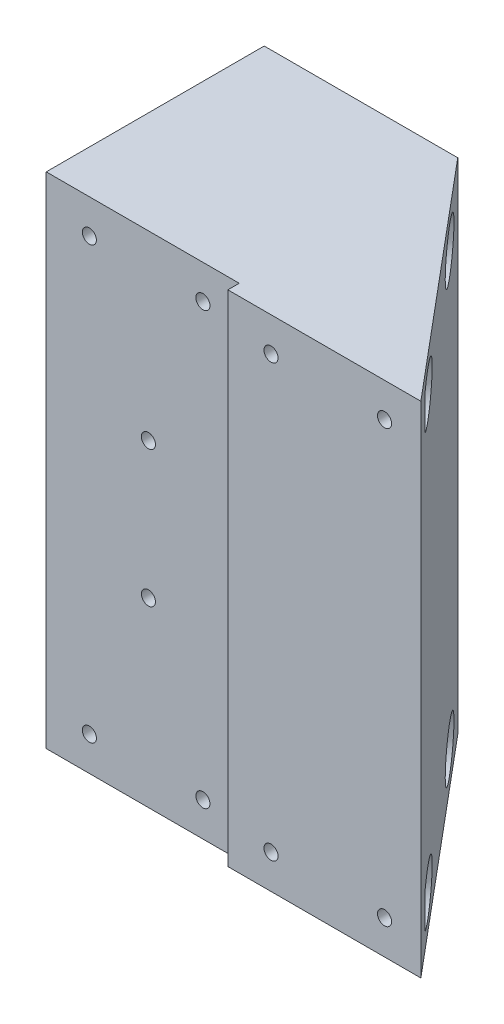
from build123d import *

# Parameters (mm, degrees)
SKETCH1_W           = 85
SKETCH1_H           = 110
BOSS_EXTRUDE1_DEPTH = 50.5
SKETCH2_W           = 42.5
SKETCH2_H           = 110
CUT_EXTRUDE1_DEPTH  = 2.5
CUT_EXTRUDE2_REACH  = 87.988
SKETCH3_W           = 130
SKETCH3_H           = 130
CUT_EXTRUDE3_REACH  = 86.47
SKETCH4_R           = 1.55
SKETCH5_R           = 1.55
CUT_EXTRUDE5_DEPTH  = 86.915656315
SKETCH9_R           = 5
CUT_EXTRUDE6_DEPTH  = 55
SKETCH10_R          = 5
CUT_EXTRUDE7_DEPTH  = 40


with BuildPart() as part:
    # Sketch1 → Boss-Extrude1 (new body)
    with BuildSketch(Plane.XY):
        Rectangle(SKETCH1_W, SKETCH1_H)
    extrude(amount=BOSS_EXTRUDE1_DEPTH)

    # Sketch2 → Cut-Extrude1 (cut)
    with BuildSketch(Plane.XY.offset(50.5)):
        with Locations((-21.25, 0)):
            Rectangle(SKETCH2_W, SKETCH2_H)
    extrude(amount=-CUT_EXTRUDE1_DEPTH, mode=Mode.SUBTRACT)

    # Sketch3 → Cut-Extrude2 (cut, up to next)
    with BuildSketch(Plane(origin=(0.073628012, 0, -0.061781238), x_dir=(0, 1, 0), z_dir=(-0.7660444431189792, 0, 0.6427876096865379)), mode=Mode.PRIVATE) as cut_extrude2_sk1:
        with Locations((-1.816321809, -4.4988995)):
            Rectangle(SKETCH3_W, SKETCH3_H)
    cut_extrude2_tool1 = extrude(cut_extrude2_sk1.sketch, amount=-CUT_EXTRUDE2_REACH, mode=Mode.PRIVATE) & part.part
    add(cut_extrude2_tool1.solids().sort_by_distance((2.965465, -1.816322, 3.384576))[0], mode=Mode.SUBTRACT)

    # Sketch4 → Cut-Extrude3 (cut, up to next)
    with BuildSketch(Plane.XY.offset(48), mode=Mode.PRIVATE) as cut_extrude3_sk1:
        with Locations((-8, 47.5)):
            Circle(SKETCH4_R)
    cut_extrude3_tool1 = extrude(cut_extrude3_sk1.sketch, amount=-CUT_EXTRUDE3_REACH, mode=Mode.PRIVATE) & part.part
    # Sketch4 → Cut-Extrude3 (cut, up to next)
    with BuildSketch(Plane.XY.offset(48), mode=Mode.PRIVATE) as cut_extrude3_sk2:
        with Locations((-33, 47.5)):
            Circle(SKETCH4_R)
    cut_extrude3_tool2 = extrude(cut_extrude3_sk2.sketch, amount=-CUT_EXTRUDE3_REACH, mode=Mode.PRIVATE) & part.part
    # Sketch4 → Cut-Extrude3 (cut, up to next)
    with BuildSketch(Plane.XY.offset(48), mode=Mode.PRIVATE) as cut_extrude3_sk3:
        with Locations((-20, 15)):
            Circle(SKETCH4_R)
    cut_extrude3_tool3 = extrude(cut_extrude3_sk3.sketch, amount=-CUT_EXTRUDE3_REACH, mode=Mode.PRIVATE) & part.part
    # Sketch4 → Cut-Extrude3 (cut, up to next)
    with BuildSketch(Plane.XY.offset(48), mode=Mode.PRIVATE) as cut_extrude3_sk4:
        with Locations((-20, -15)):
            Circle(SKETCH4_R)
    cut_extrude3_tool4 = extrude(cut_extrude3_sk4.sketch, amount=-CUT_EXTRUDE3_REACH, mode=Mode.PRIVATE) & part.part
    # Sketch4 → Cut-Extrude3 (cut, up to next)
    with BuildSketch(Plane.XY.offset(48), mode=Mode.PRIVATE) as cut_extrude3_sk5:
        with Locations((-8, -47.5)):
            Circle(SKETCH4_R)
    cut_extrude3_tool5 = extrude(cut_extrude3_sk5.sketch, amount=-CUT_EXTRUDE3_REACH, mode=Mode.PRIVATE) & part.part
    # Sketch4 → Cut-Extrude3 (cut, up to next)
    with BuildSketch(Plane.XY.offset(48), mode=Mode.PRIVATE) as cut_extrude3_sk6:
        with Locations((-33, -47.5)):
            Circle(SKETCH4_R)
    cut_extrude3_tool6 = extrude(cut_extrude3_sk6.sketch, amount=-CUT_EXTRUDE3_REACH, mode=Mode.PRIVATE) & part.part
    add(cut_extrude3_tool1.solids().sort_by_distance((-8, 47.5, 48))[0], mode=Mode.SUBTRACT)
    add(cut_extrude3_tool2.solids().sort_by_distance((-33, 47.5, 48))[0], mode=Mode.SUBTRACT)
    add(cut_extrude3_tool3.solids().sort_by_distance((-20, 15, 48))[0], mode=Mode.SUBTRACT)
    add(cut_extrude3_tool4.solids().sort_by_distance((-20, -15, 48))[0], mode=Mode.SUBTRACT)
    add(cut_extrude3_tool5.solids().sort_by_distance((-8, -47.5, 48))[0], mode=Mode.SUBTRACT)
    add(cut_extrude3_tool6.solids().sort_by_distance((-33, -47.5, 48))[0], mode=Mode.SUBTRACT)

    # Sketch5 → Cut-Extrude5 (cut, through all)
    with BuildSketch(Plane.XY.offset(50.5)):
        with Locations((9.5, 47.5)):
            Circle(SKETCH5_R)
        with Locations((34.5, 47.5)):
            Circle(SKETCH5_R)
        with Locations((34.5, -47.5)):
            Circle(SKETCH5_R)
        with Locations((9.5, -47.5)):
            Circle(SKETCH5_R)
    extrude(amount=-CUT_EXTRUDE5_DEPTH, mode=Mode.SUBTRACT)

    # Sketch9 → Cut-Extrude6 (cut)
    with BuildSketch(Plane(origin=(0, 0, -10), x_dir=(-1, 0, 0), z_dir=(0, 0, -1))):
        with Locations((-34.5, 47.5)):
            Circle(SKETCH9_R)
        with Locations((-9.5, 47.5)):
            Circle(SKETCH9_R)
        with Locations((-34.5, -47.5)):
            Circle(SKETCH9_R)
        with Locations((-9.5, -47.5)):
            Circle(SKETCH9_R)
    extrude(amount=-CUT_EXTRUDE6_DEPTH, mode=Mode.SUBTRACT)

    # Sketch10 → Cut-Extrude7 (cut)
    with BuildSketch(Plane(origin=(0, 0, 0), x_dir=(-1, 0, 0), z_dir=(0, 0, -1))):
        with Locations((8, 47.5)):
            Circle(SKETCH10_R)
        with Locations((33, 47.5)):
            Circle(SKETCH10_R)
        with Locations((33, -47.5)):
            Circle(SKETCH10_R)
        with Locations((8, -47.5)):
            Circle(SKETCH10_R)
        with Locations((20, 15)):
            Circle(SKETCH10_R)
        with Locations((20, -15)):
            Circle(SKETCH10_R)
    extrude(amount=-CUT_EXTRUDE7_DEPTH, mode=Mode.SUBTRACT)


solid = part.part
